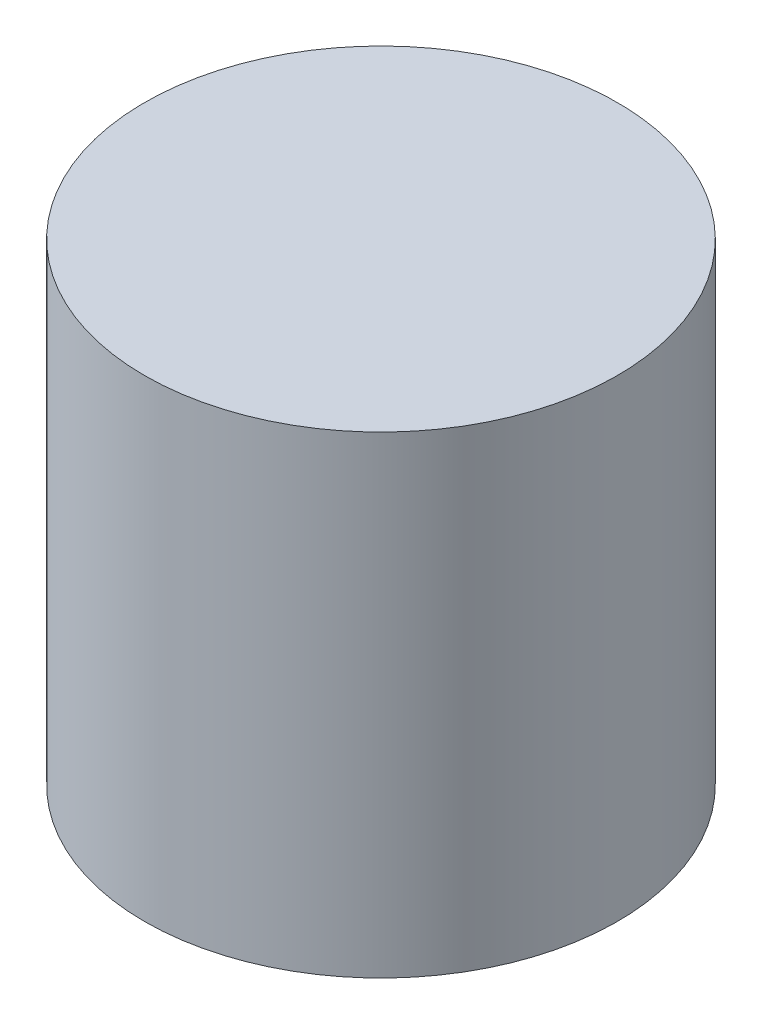
from build123d import *

# Parameters (mm, degrees)
SKETCH1_R           = 8.5
BOSS_EXTRUDE1_DEPTH = 17
SKETCH2_R           = 3
CUT_EXTRUDE1_DEPTH  = 10


with BuildPart() as part:
    # Sketch1 → Boss-Extrude1 (new body)
    with BuildSketch(Plane(origin=(0, 0, 0), x_dir=(1, 0, 0), z_dir=(0, 1, 0))):
        with Locations(Location((0, 0, 0), (0, 0, 270))):
            Circle(SKETCH1_R)
    extrude(amount=BOSS_EXTRUDE1_DEPTH)

    # Sketch2 → Cut-Extrude1 (cut)
    with BuildSketch(Plane.XZ):
        with Locations(Location((0, 0, 0), (0, 0, 270))):
            Circle(SKETCH2_R)
    extrude(amount=-CUT_EXTRUDE1_DEPTH, mode=Mode.SUBTRACT)


solid = part.part
